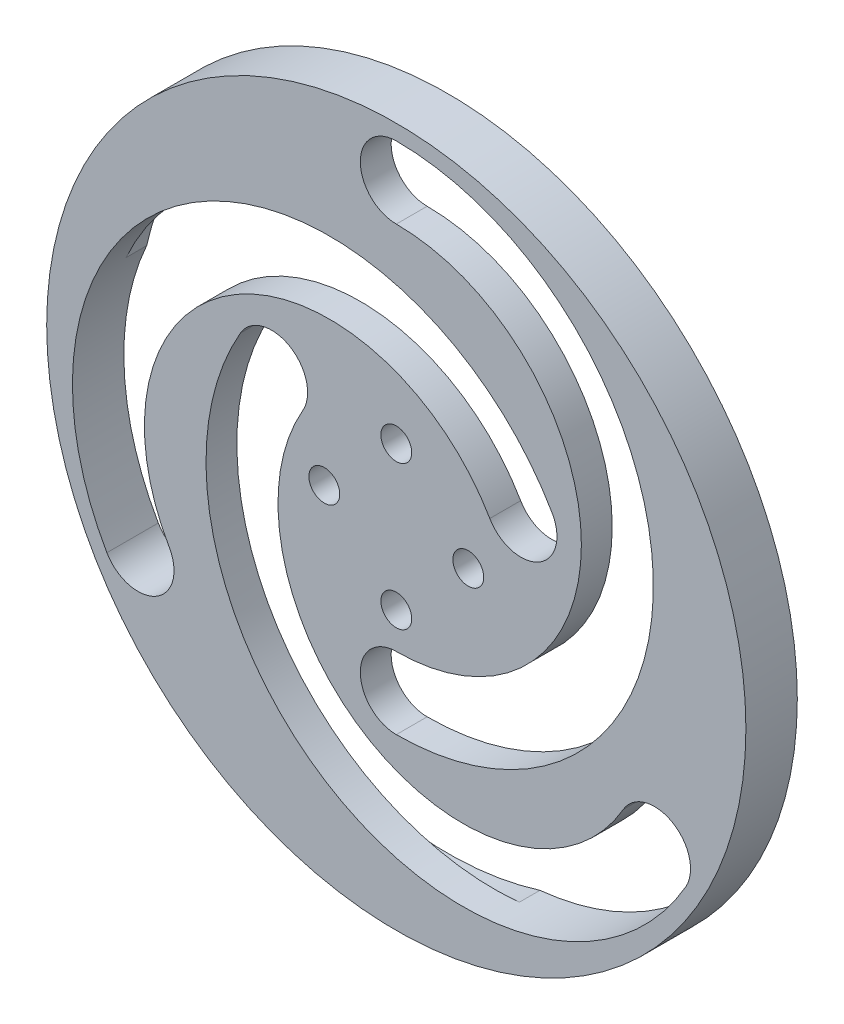
from build123d import *

# Parameters (mm, degrees)
SKETCH2_R               = 34
BOSS_EXTRUDE1_DEPTH     = 5
CUT_EXTRUDE_THIN1_REACH = 50.343
CUT_EXTRUDE1_REACH      = 50.343
SKETCH7_R               = 1.5
CUT_EXTRUDE2_REACH      = 50.343
SKETCH8_R               = 3.5
SKETCH9_R               = 30
CUT_EXTRUDE3_DEPTH      = 2


with BuildPart() as part:
    # Sketch2 → Boss-Extrude1 (new body)
    with BuildSketch(Plane.XY):
        Circle(SKETCH2_R)
    extrude(amount=BOSS_EXTRUDE1_DEPTH)

    # Sketch3 → Cut-Extrude-Thin1 (cut, up to next)
    with BuildSketch(Plane.XY.offset(5), mode=Mode.PRIVATE) as cut_extrude_thin1_sk1:
        with BuildLine():
            ThreePointArc((0, 25.5), (18, 7.5), (0, -10.5))
            Line((0, -10.5), (0, -17.5))
            ThreePointArc((0, -17.5), (25, 7.5), (0, 32.5))
            Line((0, 32.5), (0, 25.5))
        make_face()
    cut_extrude_thin1_tool1 = extrude(cut_extrude_thin1_sk1.sketch, amount=-CUT_EXTRUDE_THIN1_REACH, mode=Mode.PRIVATE) & part.part
    # Sketch3 → Cut-Extrude-Thin1 (cut, up to next)
    with BuildSketch(Plane.XY.offset(5), mode=Mode.PRIVATE) as cut_extrude_thin1_sk2:
        with BuildLine():
            ThreePointArc((22.083647797, -12.75), (-2.504809472, -19.338457268), (-9.09326674, 5.25))
            Line((-9.09326674, 5.25), (-15.155444566, 8.75))
            ThreePointArc((-15.155444566, 8.75), (-6.004809472, -25.400635095), (28.145825623, -16.25))
            Line((28.145825623, -16.25), (22.083647797, -12.75))
        make_face()
    cut_extrude_thin1_tool2 = extrude(cut_extrude_thin1_sk2.sketch, amount=-CUT_EXTRUDE_THIN1_REACH, mode=Mode.PRIVATE) & part.part
    # Sketch3 → Cut-Extrude-Thin1 (cut, up to next)
    with BuildSketch(Plane.XY.offset(5), mode=Mode.PRIVATE) as cut_extrude_thin1_sk3:
        with BuildLine():
            ThreePointArc((-22.083647797, -12.75), (-15.495190528, 11.838457268), (9.09326674, 5.25))
            Line((9.09326674, 5.25), (15.155444566, 8.75))
            ThreePointArc((15.155444566, 8.75), (-18.995190528, 17.900635095), (-28.145825623, -16.25))
            Line((-28.145825623, -16.25), (-22.083647797, -12.75))
        make_face()
    cut_extrude_thin1_tool3 = extrude(cut_extrude_thin1_sk3.sketch, amount=-CUT_EXTRUDE_THIN1_REACH, mode=Mode.PRIVATE) & part.part
    add(cut_extrude_thin1_tool1.solids().sort_by_distance((0.559017, 29, 5))[0], mode=Mode.SUBTRACT)
    add(cut_extrude_thin1_tool2.solids().sort_by_distance((-2.804081, -19.85681, 5))[0], mode=Mode.SUBTRACT)
    add(cut_extrude_thin1_tool3.solids().sort_by_distance((-15.794462, 12.35681, 5))[0], mode=Mode.SUBTRACT)

    # Sketch7 → Cut-Extrude1 (cut, up to next)
    with BuildSketch(Plane(origin=(0, 0, 0), x_dir=(-1, 0, 0), z_dir=(0, 0, -1)), mode=Mode.PRIVATE) as cut_extrude1_sk1:
        with Locations((7, 0)):
            Circle(SKETCH7_R)
    cut_extrude1_tool1 = extrude(cut_extrude1_sk1.sketch, amount=-CUT_EXTRUDE1_REACH, mode=Mode.PRIVATE) & part.part
    # Sketch7 → Cut-Extrude1 (cut, up to next)
    with BuildSketch(Plane(origin=(0, 0, 0), x_dir=(-1, 0, 0), z_dir=(0, 0, -1)), mode=Mode.PRIVATE) as cut_extrude1_sk2:
        with Locations((0, -7)):
            Circle(SKETCH7_R)
    cut_extrude1_tool2 = extrude(cut_extrude1_sk2.sketch, amount=-CUT_EXTRUDE1_REACH, mode=Mode.PRIVATE) & part.part
    # Sketch7 → Cut-Extrude1 (cut, up to next)
    with BuildSketch(Plane(origin=(0, 0, 0), x_dir=(-1, 0, 0), z_dir=(0, 0, -1)), mode=Mode.PRIVATE) as cut_extrude1_sk3:
        with Locations((-7, 0)):
            Circle(SKETCH7_R)
    cut_extrude1_tool3 = extrude(cut_extrude1_sk3.sketch, amount=-CUT_EXTRUDE1_REACH, mode=Mode.PRIVATE) & part.part
    # Sketch7 → Cut-Extrude1 (cut, up to next)
    with BuildSketch(Plane(origin=(0, 0, 0), x_dir=(-1, 0, 0), z_dir=(0, 0, -1)), mode=Mode.PRIVATE) as cut_extrude1_sk4:
        with Locations((0, 7)):
            Circle(SKETCH7_R)
    cut_extrude1_tool4 = extrude(cut_extrude1_sk4.sketch, amount=-CUT_EXTRUDE1_REACH, mode=Mode.PRIVATE) & part.part
    add(cut_extrude1_tool1.solids().sort_by_distance((-7, 0, 0))[0], mode=Mode.SUBTRACT)
    add(cut_extrude1_tool2.solids().sort_by_distance((0, -7, 0))[0], mode=Mode.SUBTRACT)
    add(cut_extrude1_tool3.solids().sort_by_distance((7, 0, 0))[0], mode=Mode.SUBTRACT)
    add(cut_extrude1_tool4.solids().sort_by_distance((0, 7, 0))[0], mode=Mode.SUBTRACT)

    # Sketch8 → Cut-Extrude2 (cut, up to next)
    with BuildSketch(Plane(origin=(0, 0, 0), x_dir=(-1, 0, 0), z_dir=(0, 0, -1)), mode=Mode.PRIVATE) as cut_extrude2_sk1:
        with Locations((0, 29)):
            Circle(SKETCH8_R)
    cut_extrude2_tool1 = extrude(cut_extrude2_sk1.sketch, amount=-CUT_EXTRUDE2_REACH, mode=Mode.PRIVATE) & part.part
    # Sketch8 → Cut-Extrude2 (cut, up to next)
    with BuildSketch(Plane(origin=(0, 0, 0), x_dir=(-1, 0, 0), z_dir=(0, 0, -1)), mode=Mode.PRIVATE) as cut_extrude2_sk2:
        with Locations((-12.124355653, 7)):
            Circle(SKETCH8_R)
    cut_extrude2_tool2 = extrude(cut_extrude2_sk2.sketch, amount=-CUT_EXTRUDE2_REACH, mode=Mode.PRIVATE) & part.part
    # Sketch8 → Cut-Extrude2 (cut, up to next)
    with BuildSketch(Plane(origin=(0, 0, 0), x_dir=(-1, 0, 0), z_dir=(0, 0, -1)), mode=Mode.PRIVATE) as cut_extrude2_sk3:
        with Locations((12.124355653, 7)):
            Circle(SKETCH8_R)
    cut_extrude2_tool3 = extrude(cut_extrude2_sk3.sketch, amount=-CUT_EXTRUDE2_REACH, mode=Mode.PRIVATE) & part.part
    # Sketch8 → Cut-Extrude2 (cut, up to next)
    with BuildSketch(Plane(origin=(0, 0, 0), x_dir=(-1, 0, 0), z_dir=(0, 0, -1)), mode=Mode.PRIVATE) as cut_extrude2_sk4:
        with Locations((25.11473671, -14.5)):
            Circle(SKETCH8_R)
    cut_extrude2_tool4 = extrude(cut_extrude2_sk4.sketch, amount=-CUT_EXTRUDE2_REACH, mode=Mode.PRIVATE) & part.part
    # Sketch8 → Cut-Extrude2 (cut, up to next)
    with BuildSketch(Plane(origin=(0, 0, 0), x_dir=(-1, 0, 0), z_dir=(0, 0, -1)), mode=Mode.PRIVATE) as cut_extrude2_sk5:
        with Locations((-25.11473671, -14.5)):
            Circle(SKETCH8_R)
    cut_extrude2_tool5 = extrude(cut_extrude2_sk5.sketch, amount=-CUT_EXTRUDE2_REACH, mode=Mode.PRIVATE) & part.part
    # Sketch8 → Cut-Extrude2 (cut, up to next)
    with BuildSketch(Plane(origin=(0, 0, 0), x_dir=(-1, 0, 0), z_dir=(0, 0, -1)), mode=Mode.PRIVATE) as cut_extrude2_sk6:
        with Locations((0, -14)):
            Circle(SKETCH8_R)
    cut_extrude2_tool6 = extrude(cut_extrude2_sk6.sketch, amount=-CUT_EXTRUDE2_REACH, mode=Mode.PRIVATE) & part.part
    add(cut_extrude2_tool1.solids().sort_by_distance((0, 29, 0))[0], mode=Mode.SUBTRACT)
    add(cut_extrude2_tool2.solids().sort_by_distance((12.124356, 7, 0))[0], mode=Mode.SUBTRACT)
    add(cut_extrude2_tool3.solids().sort_by_distance((-12.124356, 7, 0))[0], mode=Mode.SUBTRACT)
    add(cut_extrude2_tool4.solids().sort_by_distance((-25.114737, -14.5, 0))[0], mode=Mode.SUBTRACT)
    add(cut_extrude2_tool5.solids().sort_by_distance((25.114737, -14.5, 0))[0], mode=Mode.SUBTRACT)
    add(cut_extrude2_tool6.solids().sort_by_distance((0, -14, 0))[0], mode=Mode.SUBTRACT)

    # Sketch9 → Cut-Extrude3 (cut)
    with BuildSketch(Plane(origin=(0, 0, 0), x_dir=(-1, 0, 0), z_dir=(0, 0, -1))):
        Circle(SKETCH9_R)
    extrude(amount=-CUT_EXTRUDE3_DEPTH, mode=Mode.SUBTRACT)


solid = part.part
